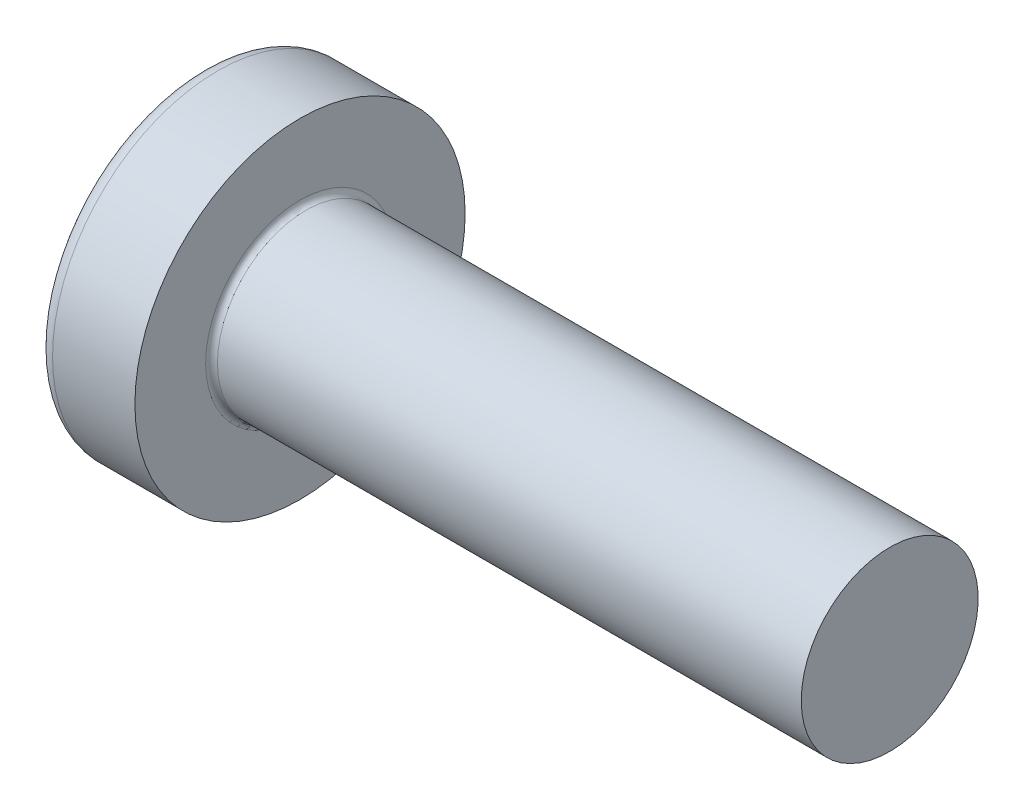
from build123d import *

# Parameters (mm, degrees)
FILLET1_R    = 0.1
RECPAT_COUNT = 2
RECPAT_ANGLE = 90


with BuildPart() as part:
    # BodySke → Base-Revolve (revolve)
    with BuildSketch(Plane.XY, mode=Mode.PRIVATE) as base_revolve_sk:
        with BuildLine():
            Line((2.4, 1.5), (2.4, 2.8))
            Line((2.4, 2.8), (1.003501533, 2.8))
            ThreePointArc((1.003501533, 2.8), (0.873295971, 2.76653015), (0.775371599, 2.674418605))
            ThreePointArc((0.775371599, 2.674418605), (0.197753546, 1.392274756), (0, 0))
            Line((0, 0), (12.4, 0))
            Line((12.4, 0), (12.4, 1.5))
            Line((12.4, 1.5), (2.4, 1.5))
        make_face()
    revolve(base_revolve_sk.sketch.rotate(Axis((1.003501533, 0, 0), (1, 0, 0)), 90), axis=Axis((1.003501533, 0, 0), (1, 0, 0)))

    # Fillet1
    fillet1_edges = [part.edges().sort_by_distance(p)[0] for p in [
        (2.4, 0, -1.5),
    ]]
    fillet(fillet1_edges, radius=FILLET1_R)

    # Sketch3 → Recess section 0
    with BuildSketch(Plane(origin=(0, 0, 0), x_dir=(0, 0, -1), z_dir=(1, 0, 0))):
        with BuildLine():
            Line((0.37, -1.4), (-0.37, -1.4))
            Line((-0.37, -1.4), (-0.37, 1.4))
            Line((-0.37, 1.4), (0.37, 1.4))
            Line((0.37, 1.4), (0.37, -1.4))
        make_face()
    # Sketch4 → Recess section 1
    with BuildSketch(Plane(origin=(1.75, 0, 0), x_dir=(0, 0, -1), z_dir=(1, 0, 0))):
        with BuildLine():
            Line((0.37, -0.527482216), (-0.37, -0.527482216))
            Line((-0.37, -0.527482216), (-0.37, 0.527482216))
            Line((-0.37, 0.527482216), (0.37, 0.527482216))
            Line((0.37, 0.527482216), (0.37, -0.527482216))
        make_face()
    recess = loft(mode=Mode.SUBTRACT)

    # RecPat: Recess ×2 about axis
    recpat_axis = Axis((0, 0, 0), (1, 0, 0))
    for i in range(1, RECPAT_COUNT):
        add(recess.rotate(recpat_axis, i * RECPAT_ANGLE / (RECPAT_COUNT - 1)), mode=Mode.SUBTRACT)

    # RecCorSke → RecessCore (revolve, cut)
    with BuildSketch(Plane.XY, mode=Mode.PRIVATE) as recesscore_sk:
        Polygon((0, 0), (0, 0.678371921), (1.75, 0.556), (1.930655351, 0), align=None)
    revolve(recesscore_sk.sketch.rotate(Axis((-3.175, 0, 0), (1, 0, 0)), 344.185974236), axis=Axis((-3.175, 0, 0), (1, 0, 0)), mode=Mode.SUBTRACT)


solid = part.part
